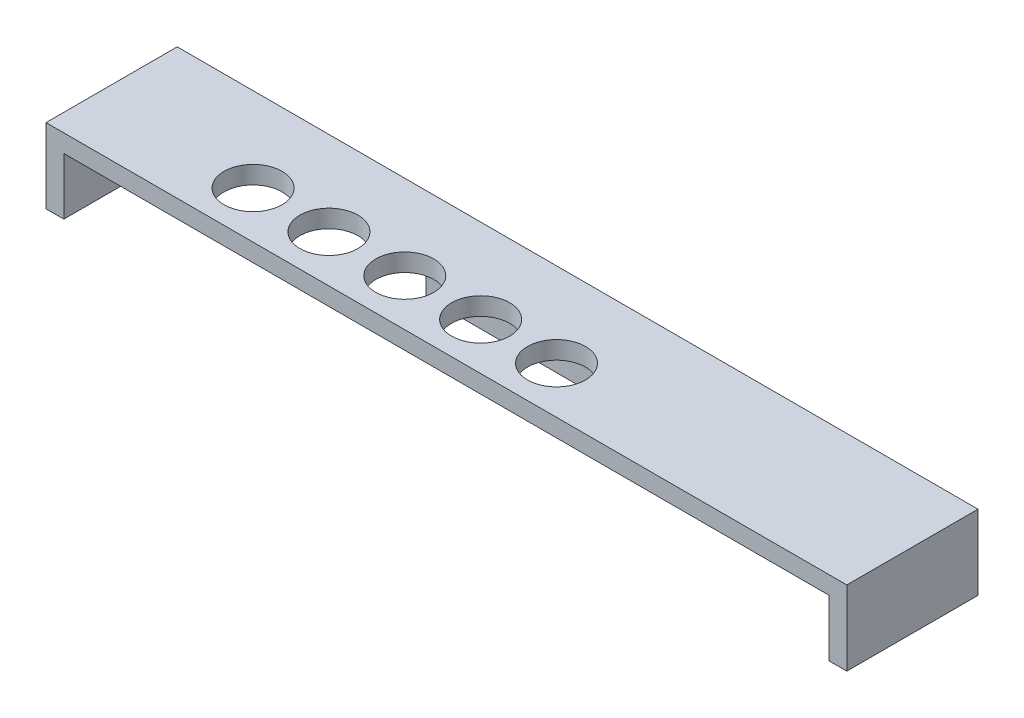
from build123d import *

# Parameters (mm, degrees)
BOSS_EXTRUDE1_DEPTH = 3.96875
SKETCH2_W           = 89.725
SKETCH2_H           = 14.7
BOSS_EXTRUDE2_DEPTH = 2
SKETCH3_R           = 3.25
CUT_EXTRUDE1_DEPTH  = 92.116911721
SKETCH4_W           = 2
SKETCH4_H           = 14.7
SKETCH4_W_2         = 30
SKETCH4_H_2         = 2
BOSS_EXTRUDE3_DEPTH = 2.4


with BuildPart() as part:
    # Sketch1 → Boss-Extrude1 (new body)
    with BuildSketch(Plane(origin=(0, 0, 0), x_dir=(1, 0, 0), z_dir=(0, 1, 0))):
        Polygon((0, 0), (0, 14.7), (89.725, 14.7), (89.725, 0), (87.725, 0), (87.725, 12.7), (2, 12.7), (2, 0), align=None)
    extrude(amount=BOSS_EXTRUDE1_DEPTH)

    # Sketch2 → Boss-Extrude2 (add)
    with BuildSketch(Plane(origin=(0, 3.96875, 0), x_dir=(1, 0, 0), z_dir=(0, 1, 0))):
        with Locations((44.8625, 7.35)):
            Rectangle(SKETCH2_W, SKETCH2_H)
    extrude(amount=BOSS_EXTRUDE2_DEPTH)

    # Sketch3 → Cut-Extrude1 (cut, through all)
    with BuildSketch(Plane(origin=(0, 5.96875, 0), x_dir=(1, 0, 0), z_dir=(0, 1, 0))):
        with Locations(Location((17.95, 5.25, 0), (0, 0, 270))):
            Circle(SKETCH3_R)
        with Locations(Location((26.45, 5.25, 0), (0, 0, 270))):
            Circle(SKETCH3_R)
        with Locations(Location((34.95, 5.25, 0), (0, 0, 270))):
            Circle(SKETCH3_R)
        with Locations(Location((43.45, 5.25, 0), (0, 0, 270))):
            Circle(SKETCH3_R)
        with Locations(Location((51.95, 5.25, 0), (0, 0, 270))):
            Circle(SKETCH3_R)
    extrude(amount=-CUT_EXTRUDE1_DEPTH, mode=Mode.SUBTRACT)

    # Sketch4 → Boss-Extrude3 (add)
    with BuildSketch(Plane(origin=(0, 0, 0), x_dir=(-1, 0, 0), z_dir=(0, -1, 0))):
        with Locations((-88.725, 7.35)):
            Rectangle(SKETCH4_W, SKETCH4_H)
        with Locations((-1, 7.35)):
            Rectangle(SKETCH4_W, SKETCH4_H)
        with Locations((-44.8625, 13.7)):
            Rectangle(SKETCH4_W_2, SKETCH4_H_2)
    extrude(amount=BOSS_EXTRUDE3_DEPTH)


solid = part.part
